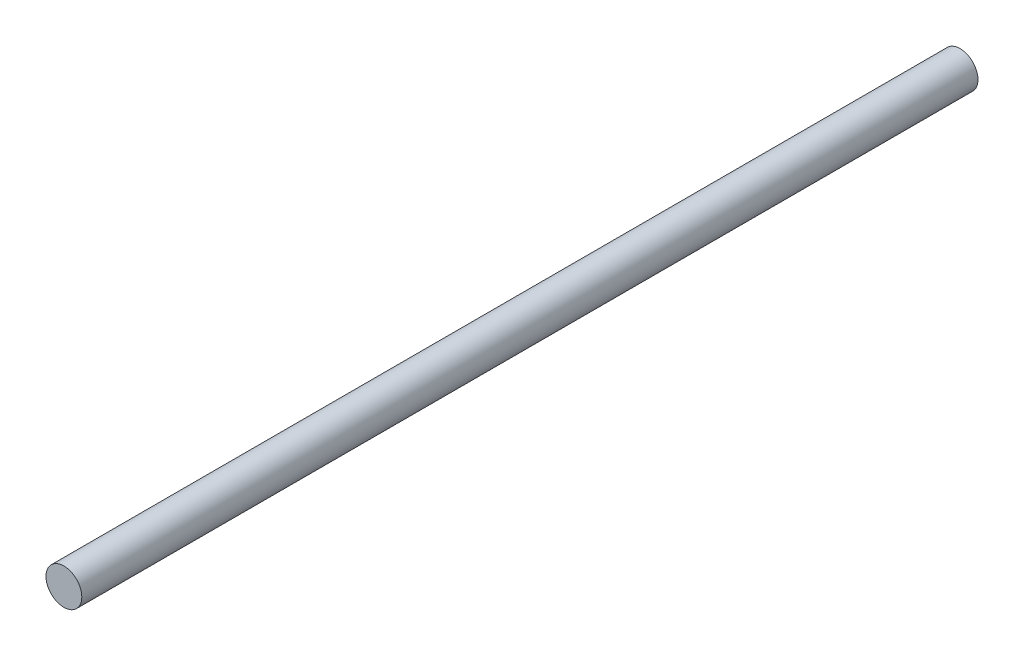
from build123d import *

# Parameters (mm, degrees)
SKETCH1_R           = 4
BOSS_EXTRUDE1_DEPTH = 100


with BuildPart() as part:
    # Sketch1 → Boss-Extrude1 (new, symmetric)
    with BuildSketch(Plane.XY):
        Circle(SKETCH1_R)
    extrude(amount=BOSS_EXTRUDE1_DEPTH, both=True)


solid = part.part
